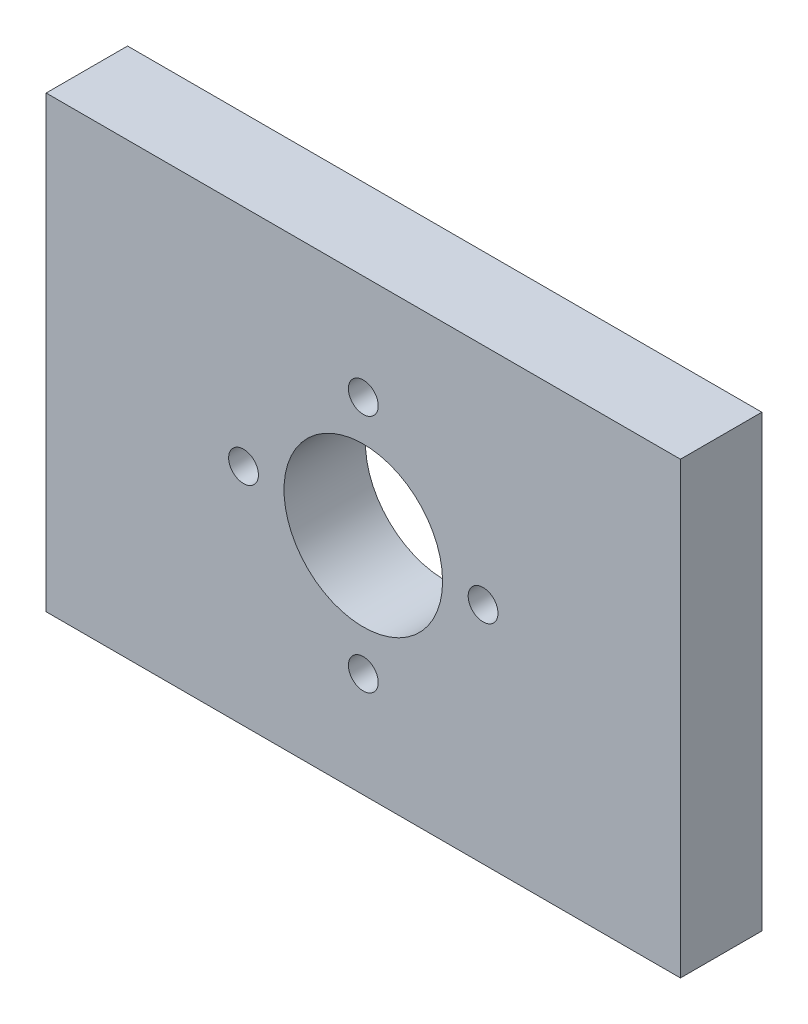
from build123d import *

# Parameters (mm, degrees)
SKETCH2_W           = 107.95
SKETCH2_H           = 152.4
BOSS_EXTRUDE1_DEPTH = 19.558
SKETCH33_R          = 19.05
CUT_EXTRUDE4_DEPTH  = 96.405744004
SKETCH35_R          = 3.5814
CUT_EXTRUDE5_DEPTH  = 96.405744004


with BuildPart() as part:
    # Sketch2 → Boss-Extrude1 (new body)
    with BuildSketch(Plane(origin=(0, 0, 0), x_dir=(0, 1, 0), z_dir=(0, 0, 1))):
        Rectangle(SKETCH2_W, SKETCH2_H)
    extrude(amount=BOSS_EXTRUDE1_DEPTH)

    # Sketch33 → Cut-Extrude4 (cut, through all)
    with BuildSketch(Plane.XY.offset(19.558)):
        Circle(SKETCH33_R)
    extrude(amount=-CUT_EXTRUDE4_DEPTH, mode=Mode.SUBTRACT)

    # Sketch35 → Cut-Extrude5 (cut, through all)
    with BuildSketch(Plane.XY.offset(19.558)):
        with Locations((0, 28.7782)):
            Circle(SKETCH35_R)
        with Locations((28.7782, 0)):
            Circle(SKETCH35_R)
        with Locations((0, -28.7782)):
            Circle(SKETCH35_R)
        with Locations((-28.7782, 0)):
            Circle(SKETCH35_R)
    extrude(amount=-CUT_EXTRUDE5_DEPTH, mode=Mode.SUBTRACT)


solid = part.part
